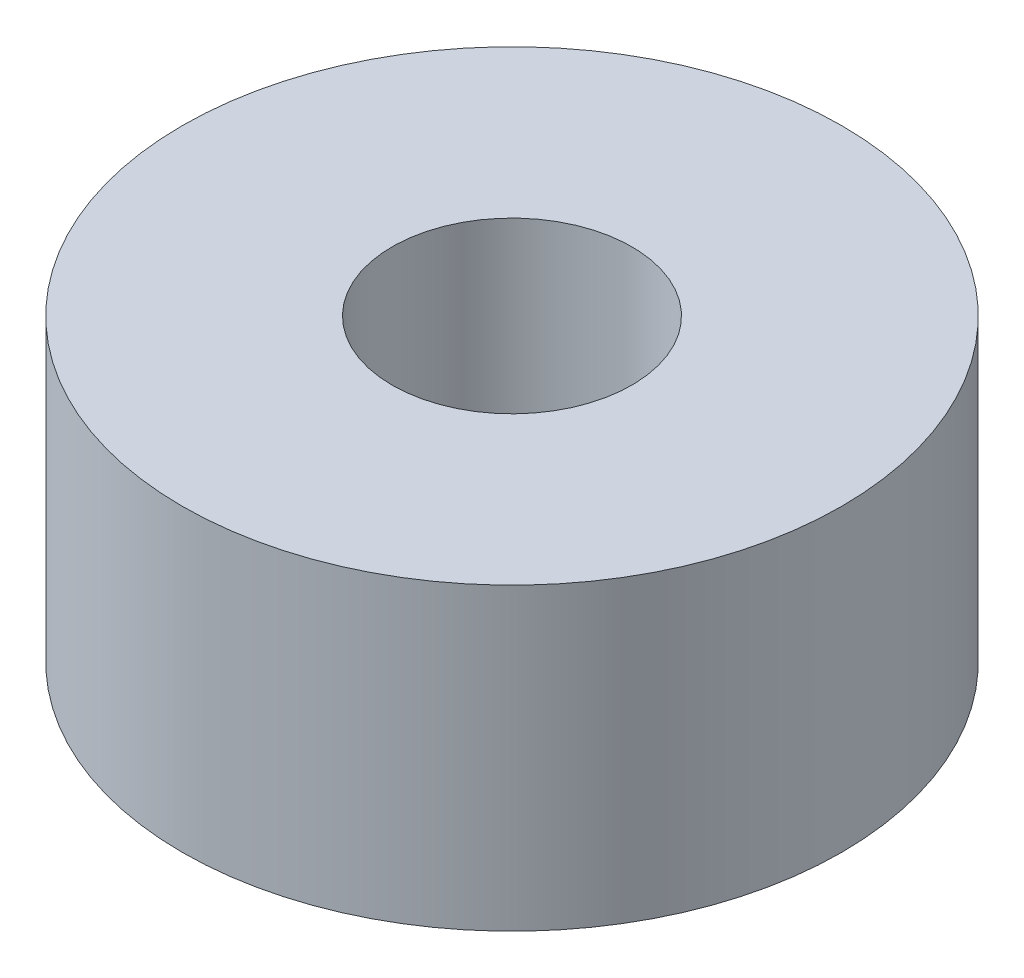
from build123d import *

# Parameters (mm, degrees)
SKETCH_1_R      = 11
SKETCH_1_R_2    = 4
EXTRUDE_1_DEPTH = 10


with BuildPart() as part:
    # 草图1 → 凸台-拉伸1 (new body)
    with BuildSketch(Plane(origin=(0, 0, 0), x_dir=(1, 0, 0), z_dir=(0, 1, 0))):
        with Locations(Location((0, 0, 0), (0, 0, 270))):
            Circle(SKETCH_1_R)
        with Locations(Location((0, 0, 0), (0, 0, 270))):
            Circle(SKETCH_1_R_2, mode=Mode.SUBTRACT)
    extrude(amount=EXTRUDE_1_DEPTH)


solid = part.part
